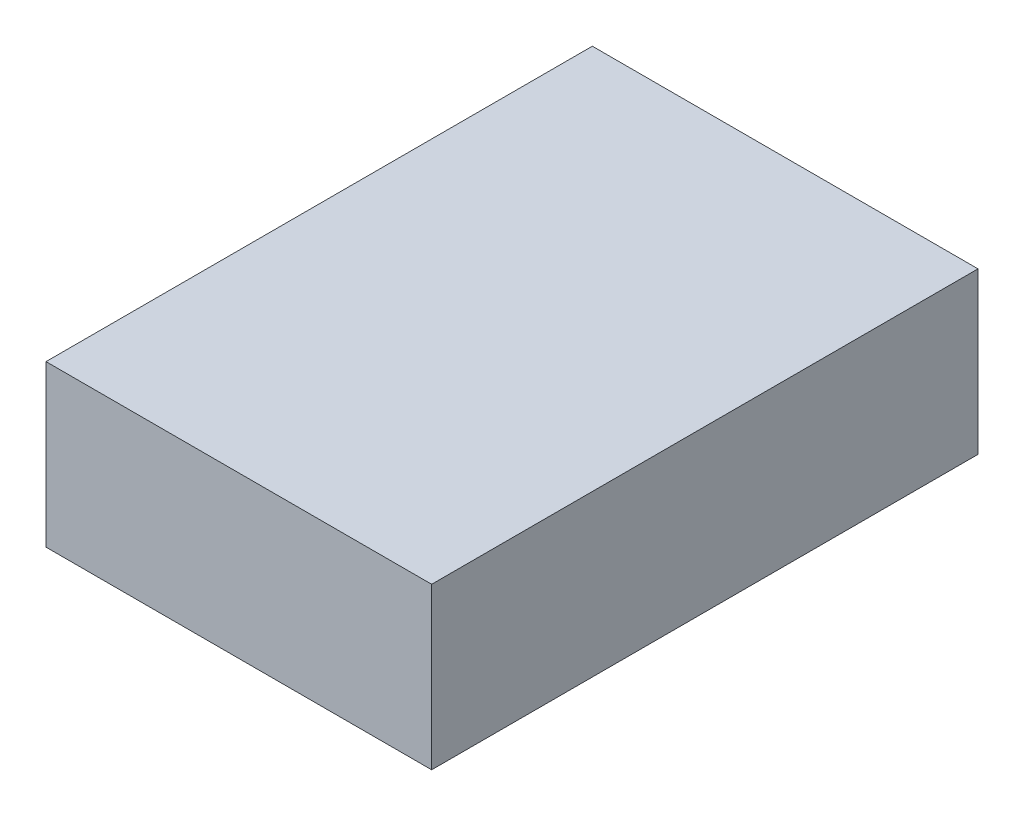
from build123d import *

# Parameters (mm, degrees)
SK_ENVELOPE_W     = 24
SK_ENVELOPE_H     = 34
EX_ENVELOPE_DEPTH = 10


with BuildPart() as part:
    # SK_Envelope → EX_Envelope (new body)
    with BuildSketch(Plane(origin=(0, 0, 0), x_dir=(1, 0, 0), z_dir=(0, 1, 0))):
        Rectangle(SK_ENVELOPE_W, SK_ENVELOPE_H)
    extrude(amount=EX_ENVELOPE_DEPTH)


solid = part.part
